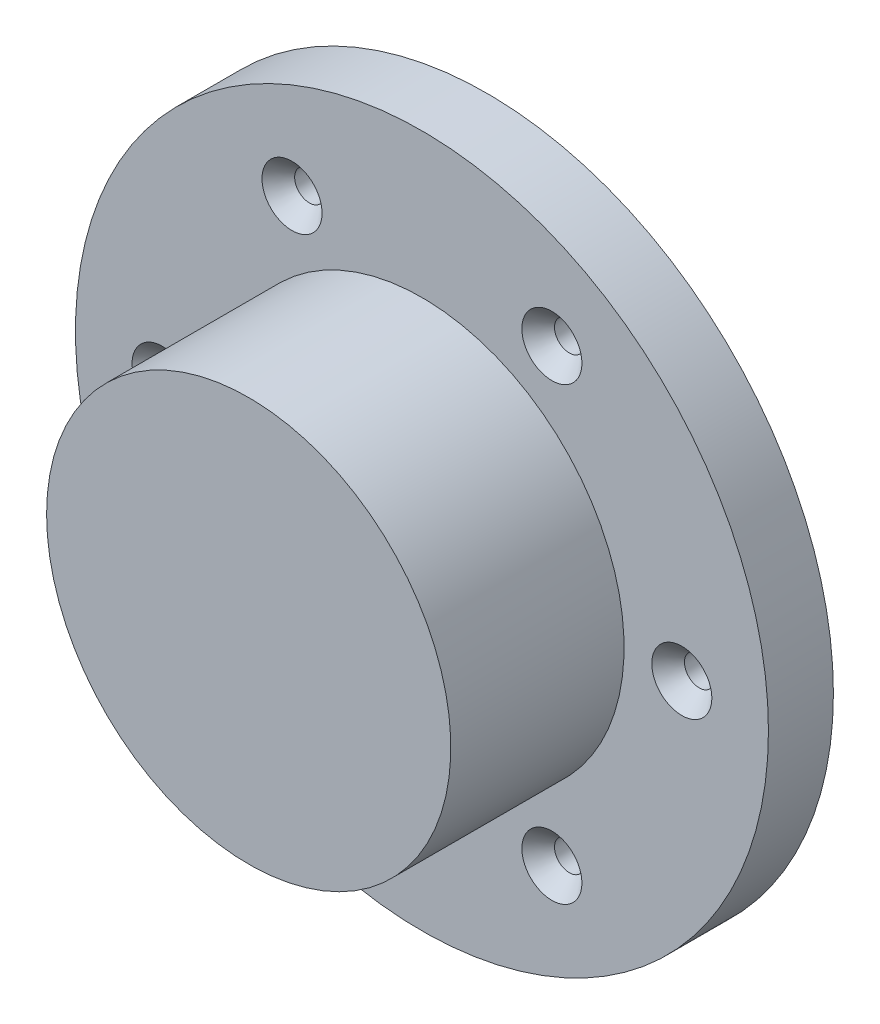
from build123d import *

# Parameters (mm, degrees)
SKETCH1_R                                     = 38.1
BOSS_EXTRUDE1_DEPTH                           = 7.14375
SKETCH3_R                                     = 22.225
BOSS_EXTRUDE2_DEPTH                           = 19.05
CSK_FOR_4_FLAT_HEAD_MACHINE_SCREW1_AT_2_COUNT = 2
CSK_FOR_4_FLAT_HEAD_MACHINE_SCREW1_AT_2_PITCH = 28.575
CSK_FOR_4_FLAT_HEAD_MACHINE_SCREW1_AT_3_COUNT = 2
CSK_FOR_4_FLAT_HEAD_MACHINE_SCREW1_AT_3_PITCH = 49.493351826
CSK_FOR_4_FLAT_HEAD_MACHINE_SCREW1_AT_4_COUNT = 2
CSK_FOR_4_FLAT_HEAD_MACHINE_SCREW1_AT_4_PITCH = 57.15
CSK_FOR_4_FLAT_HEAD_MACHINE_SCREW1_AT_5_COUNT = 2
CSK_FOR_4_FLAT_HEAD_MACHINE_SCREW1_AT_5_PITCH = 49.493351826
CSK_FOR_4_FLAT_HEAD_MACHINE_SCREW1_AT_6_COUNT = 2
CSK_FOR_4_FLAT_HEAD_MACHINE_SCREW1_AT_6_PITCH = 28.575
SKETCH11_R                                    = 17.4625
CUT_EXTRUDE1_DEPTH                            = 7.14375


with BuildPart() as part:
    # Sketch1 → Boss-Extrude1 (new body)
    with BuildSketch(Plane.XY):
        Circle(SKETCH1_R)
    extrude(amount=BOSS_EXTRUDE1_DEPTH)

    # Sketch9 → CSK for #4 Flat Head Machine Screw1 (revolve, cut)
    with BuildSketch(Plane(origin=(-28.575, 0, 7.14375), x_dir=(0, -1, 0), z_dir=(1, 0, 0))):
        Polygon((0, 0), (0, 7.14375), (1.63195, 7.14375), (1.63195, 1.921172758), (3.302, 0), align=None)
    csk_for_4_flat_head_machine_screw1 = revolve(axis=Axis((-28.575, 0, 13.49375), (0, 0, -1)), mode=Mode.SUBTRACT)

    # CSK for #4 Flat Head Machine Screw1 at 2: CSK for #4 Flat Head Machine Screw1 ×2
    with Locations(*[Vector(0.4999999999999949, 0.8660254037844416, 0) * (i * CSK_FOR_4_FLAT_HEAD_MACHINE_SCREW1_AT_2_PITCH) for i in range(1, CSK_FOR_4_FLAT_HEAD_MACHINE_SCREW1_AT_2_COUNT)]):
        add(csk_for_4_flat_head_machine_screw1, mode=Mode.SUBTRACT)

    # CSK for #4 Flat Head Machine Screw1 at 3: CSK for #4 Flat Head Machine Screw1 ×2
    with Locations(*[Vector(0.8660254037844363, 0.5000000000000041, 0) * (i * CSK_FOR_4_FLAT_HEAD_MACHINE_SCREW1_AT_3_PITCH) for i in range(1, CSK_FOR_4_FLAT_HEAD_MACHINE_SCREW1_AT_3_COUNT)]):
        add(csk_for_4_flat_head_machine_screw1, mode=Mode.SUBTRACT)

    # CSK for #4 Flat Head Machine Screw1 at 4: CSK for #4 Flat Head Machine Screw1 ×2
    with Locations(*[(i * CSK_FOR_4_FLAT_HEAD_MACHINE_SCREW1_AT_4_PITCH, 0, 0) for i in range(1, CSK_FOR_4_FLAT_HEAD_MACHINE_SCREW1_AT_4_COUNT)]):
        add(csk_for_4_flat_head_machine_screw1, mode=Mode.SUBTRACT)

    # CSK for #4 Flat Head Machine Screw1 at 5: CSK for #4 Flat Head Machine Screw1 ×2
    with Locations(*[Vector(0.8660254037844434, -0.49999999999999195, 0) * (i * CSK_FOR_4_FLAT_HEAD_MACHINE_SCREW1_AT_5_PITCH) for i in range(1, CSK_FOR_4_FLAT_HEAD_MACHINE_SCREW1_AT_5_COUNT)]):
        add(csk_for_4_flat_head_machine_screw1, mode=Mode.SUBTRACT)

    # CSK for #4 Flat Head Machine Screw1 at 6: CSK for #4 Flat Head Machine Screw1 ×2
    with Locations(*[Vector(0.5000000000000072, -0.8660254037844345, 0) * (i * CSK_FOR_4_FLAT_HEAD_MACHINE_SCREW1_AT_6_PITCH) for i in range(1, CSK_FOR_4_FLAT_HEAD_MACHINE_SCREW1_AT_6_COUNT)]):
        add(csk_for_4_flat_head_machine_screw1, mode=Mode.SUBTRACT)

    # Sketch11 → Cut-Extrude1 (cut)
    with BuildSketch(Plane(origin=(0, 0, 0), x_dir=(-1, 0, 0), z_dir=(0, 0, -1))):
        Circle(SKETCH11_R)
    extrude(amount=-CUT_EXTRUDE1_DEPTH, mode=Mode.SUBTRACT)


with BuildPart() as body_2:
    # Sketch3 → Boss-Extrude2 (new body)
    with BuildSketch(Plane.XY.offset(7.14375)):
        with Locations(Location((0, 0, 0), (0, 0, 180))):
            Circle(SKETCH3_R)
    extrude(amount=BOSS_EXTRUDE2_DEPTH)


solid = Compound([part.part, body_2.part])
